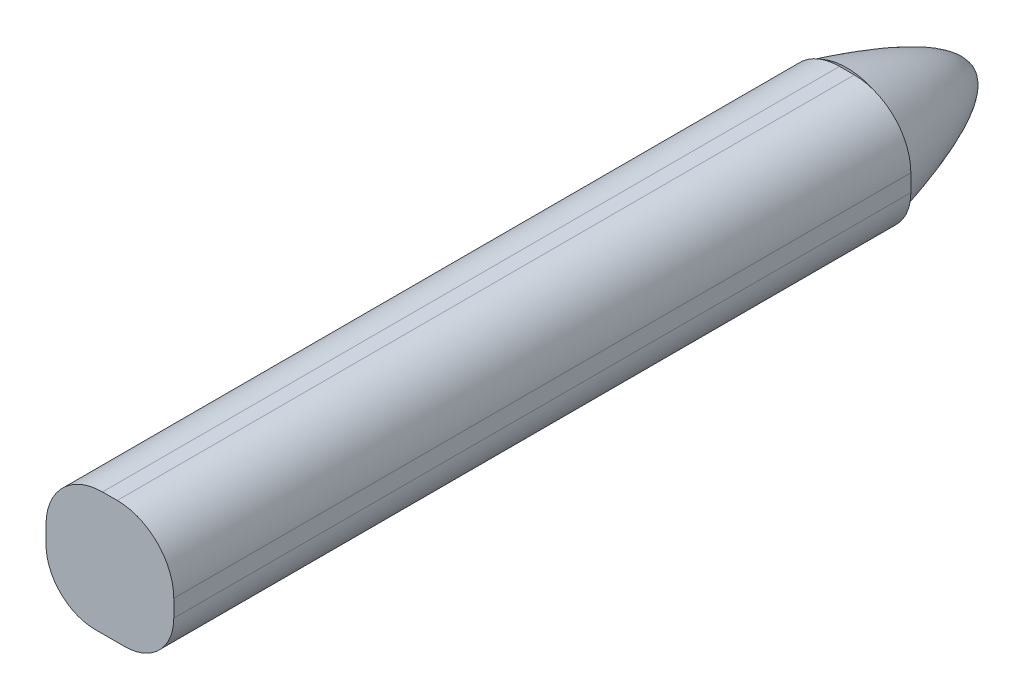
from build123d import *

# Parameters (mm, degrees)
BOSS_EXTRUDE1_DEPTH = 7500


with BuildPart() as part:
    # Sketch1 → Boss-Extrude1 (new, symmetric)
    with BuildSketch(Plane.XY):
        with BuildLine():
            Line((-300, -1250), (300, -1250))
            ThreePointArc((300, -1250), (1007.106781187, -957.106781187), (1300, -250))
            Line((1300, -250), (1300, 100))
            ThreePointArc((1300, 100), (963.172798365, 913.172798365), (150, 1250))
            Line((150, 1250), (-150, 1250))
            ThreePointArc((-150, 1250), (-963.172798365, 913.172798365), (-1300, 100))
            Line((-1300, 100), (-1300, -250))
            ThreePointArc((-1300, -250), (-1007.106781187, -957.106781187), (-300, -1250))
        make_face()
    extrude(amount=BOSS_EXTRUDE1_DEPTH, both=True)

    # Sketch2 → Revolve1 (revolve)
    with BuildSketch(Plane(origin=(0, 0, 0), x_dir=(1, 0, 0), z_dir=(0, 1, 0))):
        with BuildLine():
            Line((0, 7500), (-1300, 7500))
            add(Edge.make_bspline(
                [(-1300, 7500), (-650, 10000), (0, 10000)],
                knots=[0, 0, 0, 0.5, 0.5, 0.5], degree=2))
            Line((0, 10000), (0, 7500))
        make_face()
    revolve(axis=Axis((0, 0, -7500), (0, 0, -1)))


solid = part.part
